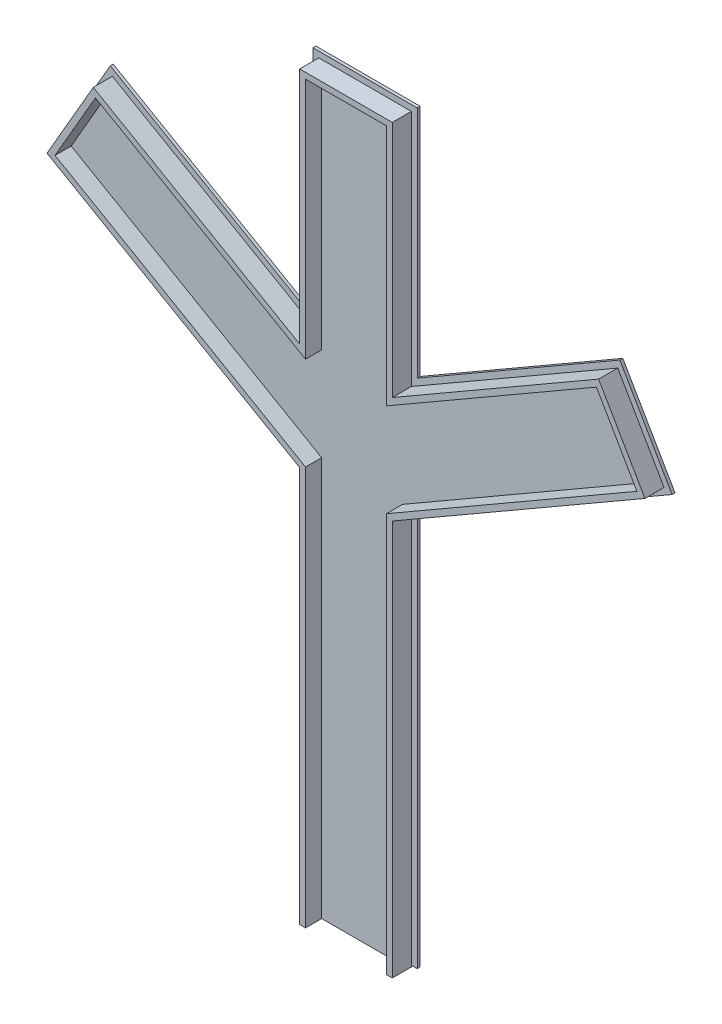
from build123d import *

# Parameters (mm, degrees)
BOSS_EXTRUDE1_DEPTH = 3
BOSS_EXTRUDE2_DEPTH = 0.8
BOSS_EXTRUDE3_DEPTH = 0.4


with BuildPart() as part:
    # Sketch1 → Boss-Extrude1 (new body)
    with BuildSketch(Plane.XY):
        Polygon((-5.5, 17), (-5.5, 71.298294078), (-39.578838325, 90.973720558), (-34.078838325, 100.5), (-5.5, 84), (-5.5, 117), (5.5, 117), (5.5, 84), (34.078838325, 100.5), (39.578838325, 90.973720558), (5.5, 71.298294078), (5.5, 17), (6.3, 17), (6.3, 70.836413862), (40.671658648, 90.680900235), (34.371658648, 101.592820323), (6.3, 85.385640646), (6.3, 117.8), (-6.3, 117.8), (-6.3, 85.385640646), (-34.371658648, 101.592820323), (-40.671658648, 90.680900235), (-6.3, 70.836413862), (-6.3, 17), align=None)
    extrude(amount=BOSS_EXTRUDE1_DEPTH)

    # Sketch2 → Boss-Extrude2 (add)
    with BuildSketch(Plane.XY):
        Polygon((-5.5, 17), (-5.5, 71.298294078), (-39.578838325, 90.973720558), (-34.078838325, 100.5), (-5.5, 84), (-5.5, 117), (5.5, 117), (5.5, 84), (34.078838325, 100.5), (39.578838325, 90.973720558), (5.5, 71.298294078), (5.5, 17), align=None)
    extrude(amount=BOSS_EXTRUDE2_DEPTH)

    # Sketch3 → Boss-Extrude3 (add)
    with BuildSketch(Plane.XY):
        Polygon((-6.3, 17.2), (-6.3, 70.836413862), (-40.671658648, 90.680900235), (-34.371658648, 101.592820323), (-6.3, 85.385640646), (-6.3, 117.8), (6.3, 117.8), (6.3, 85.385640646), (34.371658648, 101.592820323), (40.671658648, 90.680900235), (6.3, 70.836413862), (6.3, 17.2), (7.1, 17.2), (7.1, 70.374533647), (41.764478971, 90.388079912), (34.664478971, 102.685640646), (7.1, 86.771281292), (7.1, 118.6), (-7.1, 118.6), (-7.1, 86.771281292), (-34.664478971, 102.685640646), (-41.764478971, 90.388079912), (-7.1, 70.374533647), (-7.1, 17.2), align=None)
    extrude(amount=BOSS_EXTRUDE3_DEPTH)


solid = part.part
